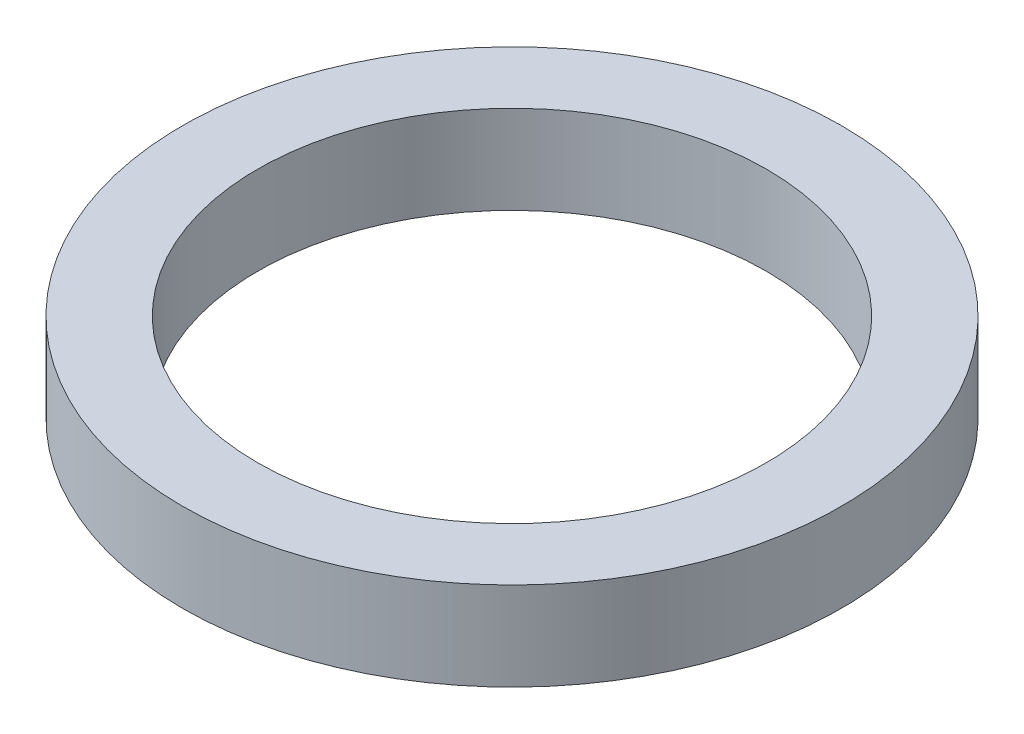
from build123d import *

# Parameters (mm, degrees)
SKETCH1_R           = 7.45
SKETCH1_R_2         = 5.75
BOSS_EXTRUDE1_DEPTH = 2


with BuildPart() as part:
    # Sketch1 → Boss-Extrude1 (new body)
    with BuildSketch(Plane(origin=(0, 0, 0), x_dir=(1, 0, 0), z_dir=(0, 1, 0))):
        with Locations(Location((0, 0, 0), (0, 0, 270))):
            Circle(SKETCH1_R)
        with Locations(Location((0, 0, 0), (0, 0, 270))):
            Circle(SKETCH1_R_2, mode=Mode.SUBTRACT)
    extrude(amount=BOSS_EXTRUDE1_DEPTH)


solid = part.part
